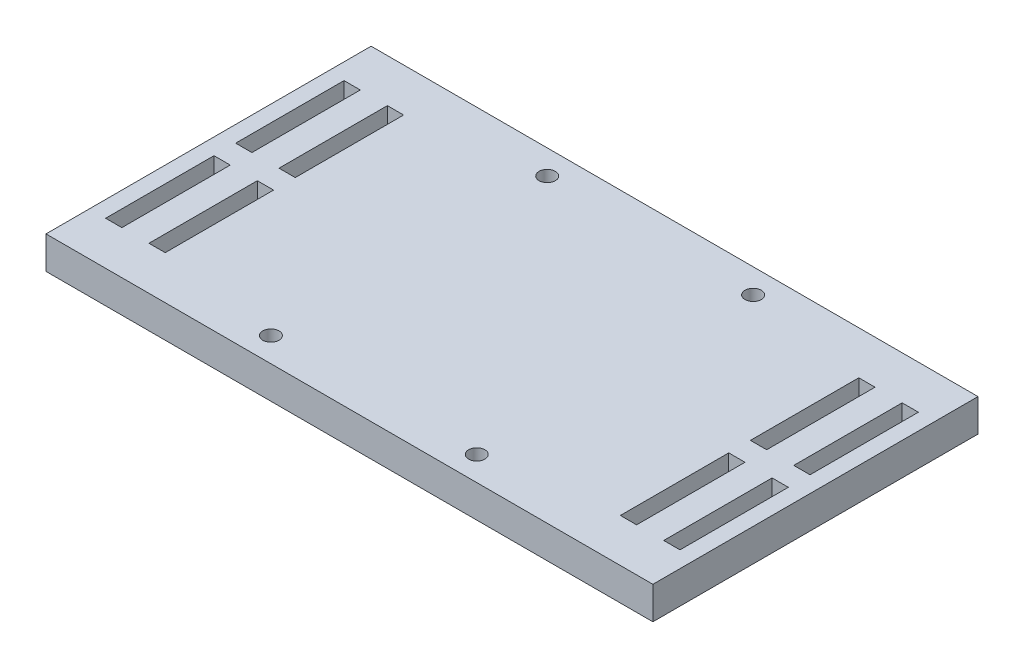
from build123d import *

# Parameters (mm, degrees)
SKETCH_1_W      = 112
SKETCH_1_H      = 60
SKETCH_1_R      = 1.5
SKETCH_1_W_2    = 3
SKETCH_1_H_2    = 20
EXTRUDE_1_DEPTH = 6


with BuildPart() as part:
    # 草图1 → 凸台-拉伸1 (new body)
    with BuildSketch(Plane(origin=(0, 0, 0), x_dir=(1, 0, 0), z_dir=(0, 1, 0))):
        with Locations((56, -30)):
            Rectangle(SKETCH_1_W, SKETCH_1_H)
        with Locations(Location((75, -4.5, 0), (0, 0, 270))):
            Circle(SKETCH_1_R, mode=Mode.SUBTRACT)
        with Locations(Location((37, -4.5, 0), (0, 0, 270))):
            Circle(SKETCH_1_R, mode=Mode.SUBTRACT)
        with Locations(Location((75, -55.5, 0), (0, 0, 270))):
            Circle(SKETCH_1_R, mode=Mode.SUBTRACT)
        with Locations(Location((37, -55.5, 0), (0, 0, 270))):
            Circle(SKETCH_1_R, mode=Mode.SUBTRACT)
        with Locations((4.5, -18)):
            Rectangle(SKETCH_1_W_2, SKETCH_1_H_2, mode=Mode.SUBTRACT)
        with Locations((4.5, -42)):
            Rectangle(SKETCH_1_W_2, SKETCH_1_H_2, mode=Mode.SUBTRACT)
        with Locations((107.5, -18)):
            Rectangle(SKETCH_1_W_2, SKETCH_1_H_2, mode=Mode.SUBTRACT)
        with Locations((107.5, -42)):
            Rectangle(SKETCH_1_W_2, SKETCH_1_H_2, mode=Mode.SUBTRACT)
        with Locations((12.5, -42)):
            Rectangle(SKETCH_1_W_2, SKETCH_1_H_2, mode=Mode.SUBTRACT)
        with Locations((12.5, -18)):
            Rectangle(SKETCH_1_W_2, SKETCH_1_H_2, mode=Mode.SUBTRACT)
        with Locations((99.5, -18)):
            Rectangle(SKETCH_1_W_2, SKETCH_1_H_2, mode=Mode.SUBTRACT)
        with Locations((99.5, -42)):
            Rectangle(SKETCH_1_W_2, SKETCH_1_H_2, mode=Mode.SUBTRACT)
    extrude(amount=EXTRUDE_1_DEPTH)


solid = part.part
